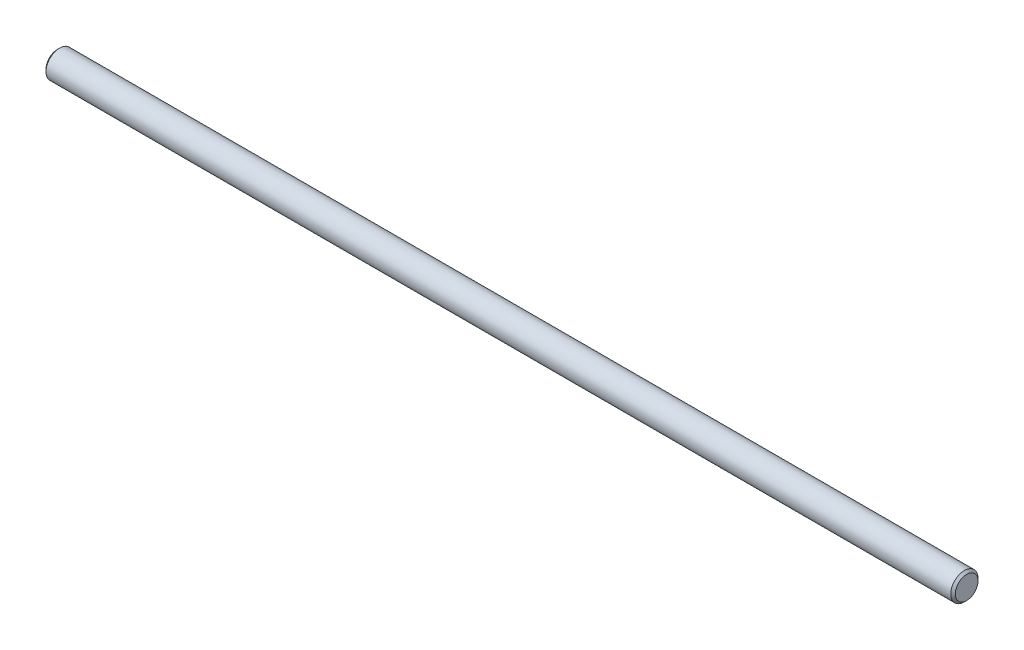
from build123d import *

# Parameters (mm, degrees)
SKETCH1_W     = 200
SKETCH1_H     = 3
CHAMFER1_SIZE = 0.5


with BuildPart() as part:
    # Sketch1 → Revolve1 (revolve)
    with BuildSketch(Plane.XY):
        with Locations((100, 1.5)):
            Rectangle(SKETCH1_W, SKETCH1_H)
    revolve(axis=Axis((0, 0, 0), (1, 0, 0)))

    # Chamfer1
    chamfer1_edges = [part.edges().sort_by_distance(p)[0] for p in [
        (200, -3, 0),
        (0, -3, 0),
    ]]
    chamfer(chamfer1_edges, length=CHAMFER1_SIZE)


solid = part.part
